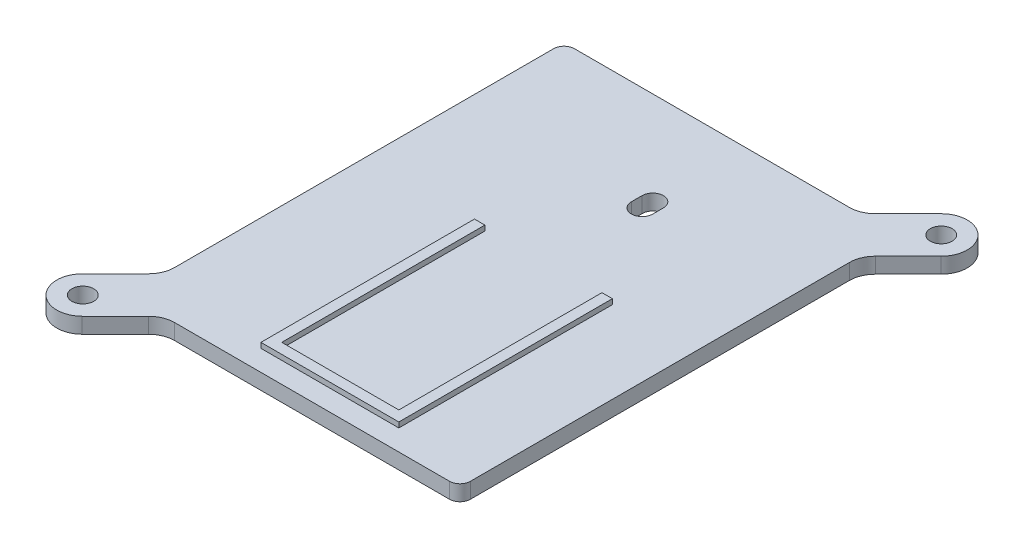
from build123d import *

# Parameters (mm, degrees)
SKETCH1_W             = 64
SKETCH1_H             = 84
BOSS_EXTRUDE1_DEPTH   = 3
BOSS_EXTRUDE2_DEPTH   = 1
SKETCH3_R             = 2.1
BOSS_EXTRUDE3_DEPTH   = 3
BOSS_EXTRUDE3_2_DEPTH = 3
FILLET3_R             = 5
FILLET4_R             = 2
CUT_EXTRUDE1_DEPTH    = 10


with BuildPart() as part:
    # Sketch1 → Boss-Extrude1 (new body)
    with BuildSketch(Plane(origin=(0, 0, 0), x_dir=(1, 0, 0), z_dir=(0, 1, 0))):
        with Locations((32, -42)):
            Rectangle(SKETCH1_W, SKETCH1_H)
    extrude(amount=BOSS_EXTRUDE1_DEPTH)

    # Sketch2 → Boss-Extrude2 (add)
    with BuildSketch(Plane(origin=(0, 3, 0), x_dir=(1, 0, 0), z_dir=(0, 1, 0))):
        Polygon((23.75, -68.961175578), (23.75, -78), (46.25, -78), (46.25, -68.961175578), (46.25, -38.961175578), (48.25, -38.961175578), (48.25, -80), (21.75, -80), (21.75, -38.961175578), (23.75, -38.961175578), align=None)
    extrude(amount=BOSS_EXTRUDE2_DEPTH)


with BuildPart() as body_2:
    # Sketch3 → Boss-Extrude3 (new body)
    with BuildSketch(Plane(origin=(0, 3, 0), x_dir=(1, 0, 0), z_dir=(0, 1, 0))):
        with BuildLine():
            Line((0, -76.928932188), (-7.778174593, -84.707106781))
            ThreePointArc((-7.778174593, -84.707106781), (-7.805302944, -91.750836469), (-0.76199118, -91.832219912))
            Line((-0.76199118, -91.832219912), (7.070228732, -84))
            Line((7.070228732, -84), (0, -76.928932188))
        make_face()
        with Locations((-4.242640687, -88.242640687)):
            Circle(SKETCH3_R, mode=Mode.SUBTRACT)
    extrude(amount=-BOSS_EXTRUDE3_DEPTH)


with BuildPart() as body_3:
    # Sketch3 → Boss-Extrude3 2 (new body)
    with BuildSketch(Plane(origin=(0, 3, 0), x_dir=(1, 0, 0), z_dir=(0, 1, 0))):
        with BuildLine():
            Line((56.928932188, 0), (64, -7.071067812))
            Line((64, -7.071067812), (71.778174593, 0.707106781))
            ThreePointArc((71.778174593, 0.707106781), (71.778174593, 7.778174593), (64.707106781, 7.778174593))
            Line((64.707106781, 7.778174593), (56.928932188, 0))
        make_face()
        with Locations((68.242640687, 4.242640687)):
            Circle(SKETCH3_R, mode=Mode.SUBTRACT)
    extrude(amount=-BOSS_EXTRUDE3_2_DEPTH)


with BuildPart() as body_2_1:
    add(body_2.part)

    # Combine2: union part, body 3
    add(part.part)
    add(body_3.part)

    # Fillet3
    fillet3_edges = [body_2_1.edges().sort_by_distance(p)[0] for p in [
        (64, 1.5, 7.071067812),
        (56.928932188, 1.5, 0),
        (0, 1.5, 76.928932188),
        (7.070228732, 1.5, 84),
    ]]
    fillet(fillet3_edges, radius=FILLET3_R)

    # Fillet4
    fillet4_edges = [body_2_1.edges().sort_by_distance(p)[0] for p in [
        (0, 1.5, 0),
        (64, 1.5, 84),
    ]]
    fillet(fillet4_edges, radius=FILLET4_R)

    # Sketch4 → Cut-Extrude1 (cut)
    with BuildSketch(Plane(origin=(0, 3, 0), x_dir=(1, 0, 0), z_dir=(0, 1, 0))):
        with BuildLine():
            Line((32.95, -17.95), (32.95, -20))
            ThreePointArc((32.95, -20), (35, -22.05), (37.05, -20))
            Line((37.05, -20), (37.05, -17.95))
            ThreePointArc((37.05, -17.95), (35, -15.9), (32.95, -17.95))
        make_face()
    extrude(amount=-CUT_EXTRUDE1_DEPTH, mode=Mode.SUBTRACT)


solid = body_2_1.part
